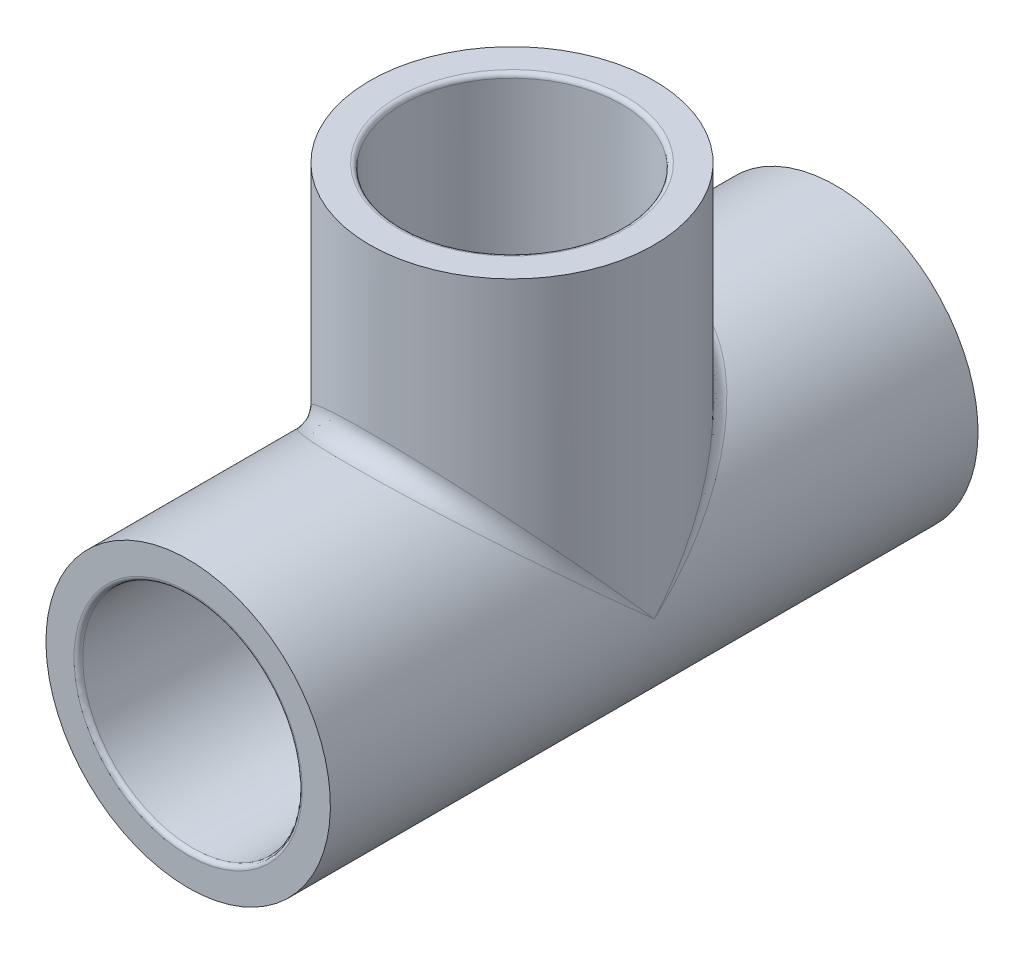
from build123d import *

# Parameters (mm, degrees)
SKETCH3_W = 63.5
SKETCH3_H = 13.9446
SKETCH4_W = 13.9446
SKETCH4_H = 31.75
FILLET1_R = 0.161925
FILLET2_R = 0.430784
FILLET3_R = 1.853565


with BuildPart() as part:
    # Sketch3 → Revolve1 (revolve)
    with BuildSketch(Plane(origin=(0, 0, 0), x_dir=(0, 0, -1), z_dir=(1, 0, 0))):
        with Locations((0, -6.9723)):
            Rectangle(SKETCH3_W, SKETCH3_H)
    revolve(axis=Axis((0, 0, 31.75), (0, 0, -1)))

    # Sketch4 → Revolve2 (revolve)
    with BuildSketch(Plane(origin=(0, 0, 0), x_dir=(0, 0, -1), z_dir=(1, 0, 0)), mode=Mode.PRIVATE) as revolve2_sk:
        with Locations((6.9723, 15.875)):
            Rectangle(SKETCH4_W, SKETCH4_H)
    revolve(revolve2_sk.sketch.rotate(Axis((0, 31.75, 0), (0, -1, 0)), 180), axis=Axis((0, 31.75, 0), (0, -1, 0)))

    # Sketch5 → Cut-Revolve1 (revolve, cut)
    with BuildSketch(Plane(origin=(0, 0, 0), x_dir=(0, 0, -1), z_dir=(1, 0, 0))):
        Polygon((-12.7, -9.9568), (12.7, -9.9568), (12.7, -10.6172), (31.75, -10.7696), (31.75, 0), (-31.75, 0), (-31.75, -10.7696), (-12.7, -10.6172), align=None)
    revolve(axis=Axis((0, 0, 31.75), (0, 0, -1)), mode=Mode.SUBTRACT)

    # Sketch6 → Cut-Revolve2 (revolve, cut)
    with BuildSketch(Plane(origin=(0, 0, 0), x_dir=(0, 0, -1), z_dir=(1, 0, 0))):
        Polygon((9.9695, 0), (9.9695, 12.7), (10.6172, 12.7), (10.7696, 31.75), (0, 31.75), (0, 0), align=None)
    revolve(axis=Axis((0, 0, 0), (0, 1, 0)), mode=Mode.SUBTRACT)

    # Fillet1
    fillet1_edges = [part.edges().sort_by_distance(p)[0] for p in [
        (0, 10.6172, 12.7),
        (0, 10.6172, -12.7),
        (0, 12.7, 10.6172),
    ]]
    fillet(fillet1_edges, radius=FILLET1_R)

    # Fillet2
    fillet2_edges = [part.edges().sort_by_distance(p)[0] for p in [
        (0, 10.7696, 31.75),
        (0, 10.7696, -31.75),
        (0, 31.75, 10.7696),
    ]]
    fillet(fillet2_edges, radius=FILLET2_R)

    # Fillet3
    fillet3_edges = [part.edges().sort_by_distance(p)[0] for p in [
        (10.643857585, 9.008893654, 9.008893654),
        (-1.5516e-05, 13.9446, -13.9446),
    ]]
    fillet(fillet3_edges, radius=FILLET3_R)


solid = part.part
